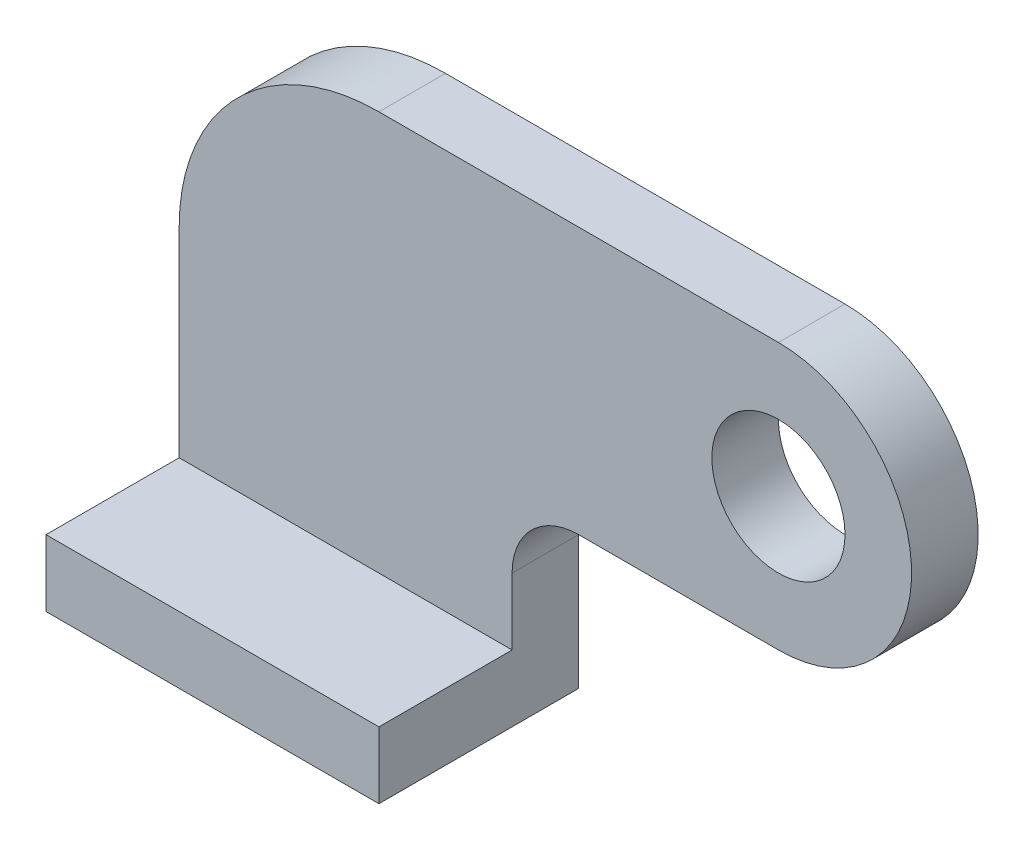
from build123d import *

# Parameters (mm, degrees)
SKETCH1_W           = 63.5
SKETCH1_H           = 12.7
BOSS_EXTRUDE1_DEPTH = 38.1
SKETCH1_4_R         = 12.7
BOSS_EXTRUDE2_DEPTH = 12.7


with BuildPart() as part:
    # Sketch1 → Boss-Extrude1 (new body)
    with BuildSketch(Plane.XY):
        with Locations((31.75, 6.35)):
            Rectangle(SKETCH1_W, SKETCH1_H)
    extrude(amount=BOSS_EXTRUDE1_DEPTH)

    # Sketch1<4> → Boss-Extrude2 (add)
    with BuildSketch(Plane.XY):
        with BuildLine():
            Line((0, 50.8), (0, 12.7))
            Line((0, 12.7), (63.5, 12.7))
            Line((63.5, 12.7), (63.5, 25.4))
            ThreePointArc((63.5, 25.4), (67.219743879, 34.380256121), (76.2, 38.1))
            Line((76.2, 38.1), (114.3, 38.1))
            ThreePointArc((114.3, 38.1), (139.7, 63.5), (114.3, 88.9))
            Line((114.3, 88.9), (38.1, 88.9))
            ThreePointArc((38.1, 88.9), (11.159231637, 77.740768363), (0, 50.8))
        make_face()
        with Locations((114.3, 63.5)):
            Circle(SKETCH1_4_R, mode=Mode.SUBTRACT)
    extrude(amount=BOSS_EXTRUDE2_DEPTH)


solid = part.part
